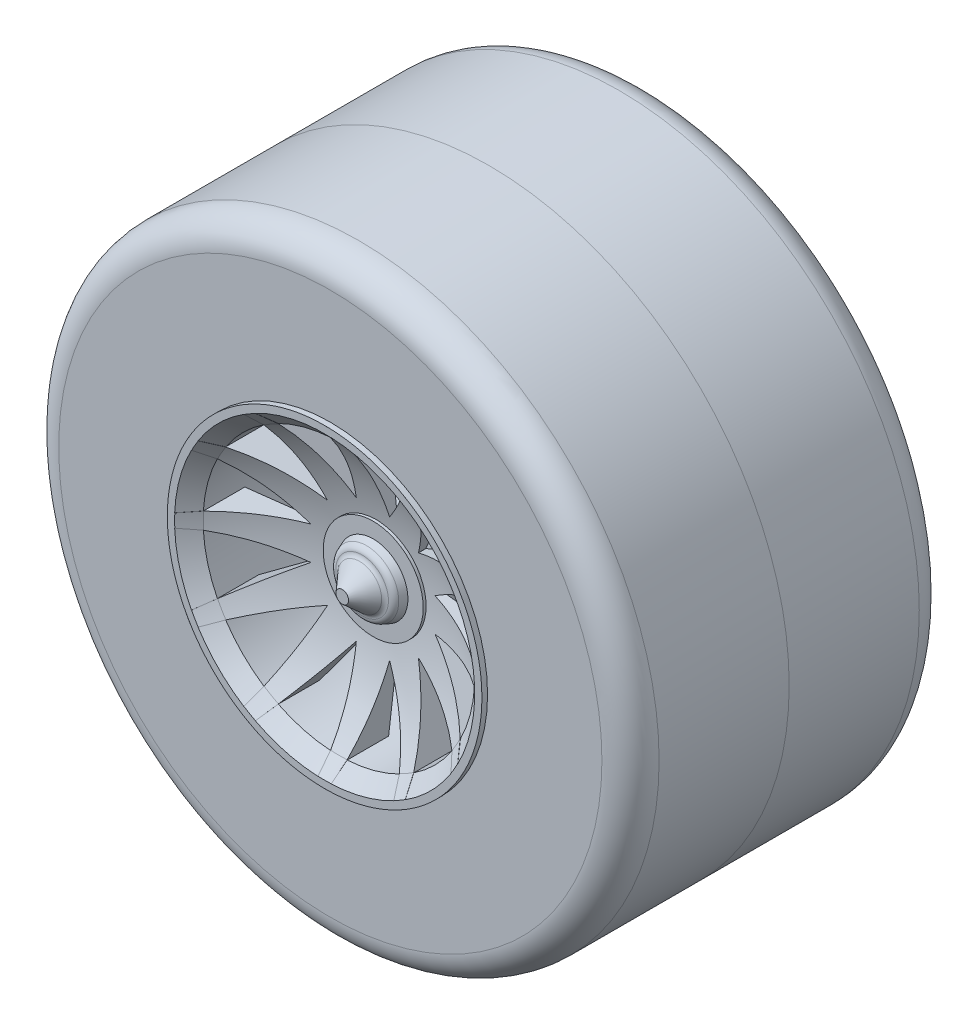
from build123d import *

# Parameters (mm, degrees)
CUT_EXTRUDE3_DEPTH       = 32.847291879
CUT_EXTRUDE3_DEPTH_BACK  = 32.847291879
SKETCH3_R                = 9.5
CHAMFER1_SIZE            = 1
BOSS_EXTRUDE1_DEPTH      = 10
BOSS_EXTRUDE1_DEPTH_BACK = 3.5
FILLET1_R                = 0.5
FILLET2_R                = 0.5
BOSS_EXTRUDE2_START      = -3
SKETCH7_R                = 3.5
BOSS_EXTRUDE2_DEPTH      = 15
SKETCH8_R                = 2.5
CUT_EXTRUDE4_DEPTH       = 5


with BuildPart() as part:
    # Sketch1 → Revolve1 (revolve)
    with BuildSketch(Plane(origin=(0, 0, 0), x_dir=(0, 0, -1), z_dir=(1, 0, 0)), mode=Mode.PRIVATE) as revolve1_sk:
        with BuildLine():
            Line((0, 0), (0, 21))
            Line((0, 21), (-9.1, 21))
            ThreePointArc((-9.1, 21), (-10.514213562, 20.414213562), (-11.1, 19))
            Line((-11.1, 19), (-11.1, 11))
            Line((-11.1, 11), (-11.5, 11))
            Line((-11.5, 11), (-11.5, 0))
            Line((-11.5, 0), (0, 0))
        make_face()
    revolve(revolve1_sk.sketch.rotate(Axis((0, 0, 11.5), (0, 0, -1)), 90), axis=Axis((0, 0, 11.5), (0, 0, -1)))

    # Sketch3 → Cut-Extrude3 (cut, two sides: drawn at the far end of the back side and taken through both)
    with BuildSketch(Plane.XY.offset(11.5).offset(-CUT_EXTRUDE3_DEPTH_BACK)):
        Circle(SKETCH3_R)
    extrude(amount=CUT_EXTRUDE3_DEPTH + CUT_EXTRUDE3_DEPTH_BACK, mode=Mode.SUBTRACT)

    # Chamfer1
    chamfer1_edges = [part.edges().sort_by_distance(p)[0] for p in [
        (-9.5, 0, 11.5),
    ]]
    chamfer(chamfer1_edges, length=CHAMFER1_SIZE)

    # Sketch4 → Boss-Extrude1 (add, two sides: drawn at the far end of the back side and taken through both)
    with BuildSketch(Plane.XY.offset(11.1).offset(-BOSS_EXTRUDE1_DEPTH_BACK)):
        with BuildLine():
            ThreePointArc((-0.23054429, 10.997583795), (-0.3610789, 10.945441181), (-0.425064982, 10.820285606))
            Line((-0.425064982, 10.820285606), (-1.163163089, 4.347073916))
            ThreePointArc((-1.163163089, 4.347073916), (-1.164685703, 4.346666218), (-1.166208174, 4.346257988))
            Line((-1.166208174, 4.346257988), (-5.04202573, 9.583174702))
            ThreePointArc((-5.04202573, 9.583174702), (-5.16001709, 9.659569568), (-5.299134686, 9.639459092))
            ThreePointArc((-5.299134686, 9.639459092), (-5.5, 9.526279442), (-5.698449109, 9.408914802))
            ThreePointArc((-5.698449109, 9.408914802), (-5.785424091, 9.298490668), (-5.778259875, 9.15810972))
            Line((-5.778259875, 9.15810972), (-3.18926976, 3.202427401))
            ThreePointArc((-3.18926976, 3.202427401), (-3.191369638, 3.191369638), (-3.202427401, 3.18926976))
            Line((-3.202427401, 3.18926976), (-9.15810972, 5.778259875))
            ThreePointArc((-9.15810972, 5.778259875), (-9.298490668, 5.785424091), (-9.408914802, 5.698449109))
            ThreePointArc((-9.408914802, 5.698449109), (-9.526279442, 5.5), (-9.639459092, 5.299134686))
            ThreePointArc((-9.639459092, 5.299134686), (-9.659569568, 5.16001709), (-9.583174702, 5.04202573))
            Line((-9.583174702, 5.04202573), (-4.346257988, 1.166208174))
            ThreePointArc((-4.346257988, 1.166208174), (-4.346666218, 1.164685703), (-4.347073916, 1.163163089))
            Line((-4.347073916, 1.163163089), (-10.820285606, 0.425064982))
            ThreePointArc((-10.820285606, 0.425064982), (-10.945441181, 0.3610789), (-10.997583795, 0.23054429))
            ThreePointArc((-10.997583795, 0.23054429), (-11, 0), (-10.997583795, -0.23054429))
            ThreePointArc((-10.997583795, -0.23054429), (-10.945441181, -0.3610789), (-10.820285606, -0.425064982))
            Line((-10.820285606, -0.425064982), (-4.347073916, -1.163163089))
            ThreePointArc((-4.347073916, -1.163163089), (-4.346666218, -1.164685703), (-4.346257988, -1.166208174))
            Line((-4.346257988, -1.166208174), (-9.583174702, -5.04202573))
            ThreePointArc((-9.583174702, -5.04202573), (-9.659569568, -5.16001709), (-9.639459092, -5.299134686))
            ThreePointArc((-9.639459092, -5.299134686), (-9.526279442, -5.5), (-9.408914802, -5.698449109))
            ThreePointArc((-9.408914802, -5.698449109), (-9.298490668, -5.785424091), (-9.15810972, -5.778259875))
            Line((-9.15810972, -5.778259875), (-3.183094898, -3.180865742))
            ThreePointArc((-3.183094898, -3.180865742), (-3.181980515, -3.181980515), (-3.180865742, -3.183094898))
            Line((-3.180865742, -3.183094898), (-5.778259875, -9.15810972))
            ThreePointArc((-5.778259875, -9.15810972), (-5.785424091, -9.298490668), (-5.698449109, -9.408914802))
            ThreePointArc((-5.698449109, -9.408914802), (-5.5, -9.526279442), (-5.299134686, -9.639459092))
            ThreePointArc((-5.299134686, -9.639459092), (-5.16001709, -9.659569568), (-5.04202573, -9.583174702))
            Line((-5.04202573, -9.583174702), (-1.166208174, -4.346257988))
            ThreePointArc((-1.166208174, -4.346257988), (-1.164685703, -4.346666218), (-1.163163089, -4.347073916))
            Line((-1.163163089, -4.347073916), (-0.425064982, -10.820285606))
            ThreePointArc((-0.425064982, -10.820285606), (-0.3610789, -10.945441181), (-0.23054429, -10.997583795))
            ThreePointArc((-0.23054429, -10.997583795), (0, -11), (0.23054429, -10.997583795))
            ThreePointArc((0.23054429, -10.997583795), (0.3610789, -10.945441181), (0.425064982, -10.820285606))
            Line((0.425064982, -10.820285606), (1.163163089, -4.347073916))
            ThreePointArc((1.163163089, -4.347073916), (1.164685703, -4.346666218), (1.166208174, -4.346257988))
            Line((1.166208174, -4.346257988), (5.04202573, -9.583174702))
            ThreePointArc((5.04202573, -9.583174702), (5.16001709, -9.659569568), (5.299134686, -9.639459092))
            ThreePointArc((5.299134686, -9.639459092), (5.5, -9.526279442), (5.698449109, -9.408914802))
            ThreePointArc((5.698449109, -9.408914802), (5.785424091, -9.298490668), (5.778259875, -9.15810972))
            Line((5.778259875, -9.15810972), (3.180865742, -3.183094898))
            ThreePointArc((3.180865742, -3.183094898), (3.181980515, -3.181980515), (3.183094898, -3.180865742))
            Line((3.183094898, -3.180865742), (9.15810972, -5.778259875))
            ThreePointArc((9.15810972, -5.778259875), (9.298490668, -5.785424091), (9.408914802, -5.698449109))
            ThreePointArc((9.408914802, -5.698449109), (9.526279442, -5.5), (9.639459092, -5.299134686))
            ThreePointArc((9.639459092, -5.299134686), (9.659569568, -5.16001709), (9.583174702, -5.04202573))
            Line((9.583174702, -5.04202573), (4.346257988, -1.166208174))
            ThreePointArc((4.346257988, -1.166208174), (4.346666218, -1.164685703), (4.347073916, -1.163163089))
            Line((4.347073916, -1.163163089), (10.820285606, -0.425064982))
            ThreePointArc((10.820285606, -0.425064982), (10.945441181, -0.3610789), (10.997583795, -0.23054429))
            ThreePointArc((10.997583795, -0.23054429), (11, 0), (10.997583795, 0.23054429))
            ThreePointArc((10.997583795, 0.23054429), (10.945441181, 0.3610789), (10.820285606, 0.425064982))
            Line((10.820285606, 0.425064982), (4.347073916, 1.163163089))
            ThreePointArc((4.347073916, 1.163163089), (4.346666218, 1.164685703), (4.346257988, 1.166208174))
            Line((4.346257988, 1.166208174), (9.583174702, 5.04202573))
            ThreePointArc((9.583174702, 5.04202573), (9.659569568, 5.16001709), (9.639459092, 5.299134686))
            ThreePointArc((9.639459092, 5.299134686), (9.526279442, 5.5), (9.408914802, 5.698449109))
            ThreePointArc((9.408914802, 5.698449109), (9.298490668, 5.785424091), (9.15810972, 5.778259875))
            Line((9.15810972, 5.778259875), (3.183094898, 3.180865742))
            ThreePointArc((3.183094898, 3.180865742), (3.181980515, 3.181980515), (3.180865742, 3.183094898))
            Line((3.180865742, 3.183094898), (5.778259875, 9.15810972))
            ThreePointArc((5.778259875, 9.15810972), (5.785424091, 9.298490668), (5.698449109, 9.408914802))
            ThreePointArc((5.698449109, 9.408914802), (5.5, 9.526279442), (5.299134686, 9.639459092))
            ThreePointArc((5.299134686, 9.639459092), (5.16001709, 9.659569568), (5.04202573, 9.583174702))
            Line((5.04202573, 9.583174702), (1.166208174, 4.346257988))
            ThreePointArc((1.166208174, 4.346257988), (1.164685703, 4.346666218), (1.163163089, 4.347073916))
            Line((1.163163089, 4.347073916), (0.425064982, 10.820285606))
            ThreePointArc((0.425064982, 10.820285606), (0.3610789, 10.945441181), (0.23054429, 10.997583795))
            ThreePointArc((0.23054429, 10.997583795), (0, 11), (-0.23054429, 10.997583795))
        make_face()
    extrude(amount=BOSS_EXTRUDE1_DEPTH + BOSS_EXTRUDE1_DEPTH_BACK)

    # Sketch5 → Cut-Revolve1 (revolve, cut)
    with BuildSketch(Plane(origin=(0, 0, 0), x_dir=(0, 0, -1), z_dir=(1, 0, 0)), mode=Mode.PRIVATE) as cut_revolve1_sk:
        with BuildLine():
            Line((-10.5, 9.482423934), (-11.5, 10.489798091))
            Line((-11.5, 10.489798091), (-11.5, 10.997583795))
            Line((-11.5, 10.997583795), (-11.881155233, 11.615314495))
            Line((-11.881155233, 11.615314495), (-21.69459493, 11.615314495))
            Line((-21.69459493, 11.615314495), (-21.69459493, 0))
            Line((-21.69459493, 0), (-7.549667756, 0))
            add(Edge.make_bspline(
                [(-10.5, 9.482423934), (-7.625200193, 5.725081093), (-7.549667756, 0)],
                knots=[0, 0, 0, 1, 1, 1], degree=2))
        make_face()
    revolve(cut_revolve1_sk.sketch.rotate(Axis((0, 0, 21.69459493), (0, 0, -1)), 90), axis=Axis((0, 0, 21.69459493), (0, 0, -1)), mode=Mode.SUBTRACT)


with BuildPart() as body_2:
    # Sketch6 → Revolve2 (revolve)
    with BuildSketch(Plane(origin=(0, 0, 0), x_dir=(0, 0, -1), z_dir=(1, 0, 0)), mode=Mode.PRIVATE) as revolve2_sk:
        Polygon((-7.432158037, 0), (-7.91810881, 2.5), (-8.874878477, 2.128000744), (-8.874878477, 1.68167392), (-10.263450817, 0.441877187), (-10.263450817, 0), align=None)
    revolve(revolve2_sk.sketch.rotate(Axis((0, 0, 0), (0, 0, 1)), 90), axis=Axis((0, 0, 0), (0, 0, 1)))

    # Fillet1
    fillet1_edges = [body_2.edges().sort_by_distance(p)[0] for p in [
        (1.68167392, 0, 8.874878477),
    ]]
    fillet(fillet1_edges, radius=FILLET1_R)

    # Fillet2
    fillet2_edges = [body_2.edges().sort_by_distance(p)[0] for p in [
        (2.128000744, 0, 8.874878477),
    ]]
    fillet(fillet2_edges, radius=FILLET2_R)


with BuildPart() as body_3:
    # Mirror1: mirrored copy
    add(part.part.mirror(Plane.XY))


with BuildPart() as body_4:
    # Mirror1 2: mirrored copy
    add(body_2.part.mirror(Plane.XY))


with BuildPart() as body_2_1:
    add(body_2.part)

    # Sketch7 → Boss-Extrude2 (add)
    with BuildSketch(Plane.XY.offset(11.1).offset(BOSS_EXTRUDE2_START)):
        Circle(SKETCH7_R)
    extrude(amount=-BOSS_EXTRUDE2_DEPTH)


with BuildPart() as cut_extrude4_tool:
    # Sketch8 → Cut-Extrude4 (new body)
    with BuildSketch(Plane(origin=(0, 0, -11.1), x_dir=(-1, 0, 0), z_dir=(0, 0, -1))):
        Circle(SKETCH8_R)
    extrude(amount=-CUT_EXTRUDE4_DEPTH)


with BuildPart() as body_2_2:
    add(body_2_1.part)

    # Cut-Extrude4: cut by cut_extrude4_tool
    add(cut_extrude4_tool.part, mode=Mode.SUBTRACT)


with BuildPart() as body_3_1:
    add(body_3.part)

    # Cut-Extrude4: cut by cut_extrude4_tool
    add(cut_extrude4_tool.part, mode=Mode.SUBTRACT)


with BuildPart() as body_4_1:
    add(body_4.part)

    # Cut-Extrude4: cut by cut_extrude4_tool
    add(cut_extrude4_tool.part, mode=Mode.SUBTRACT)


solid = Compound([part.part, body_2_2.part, body_3_1.part])
